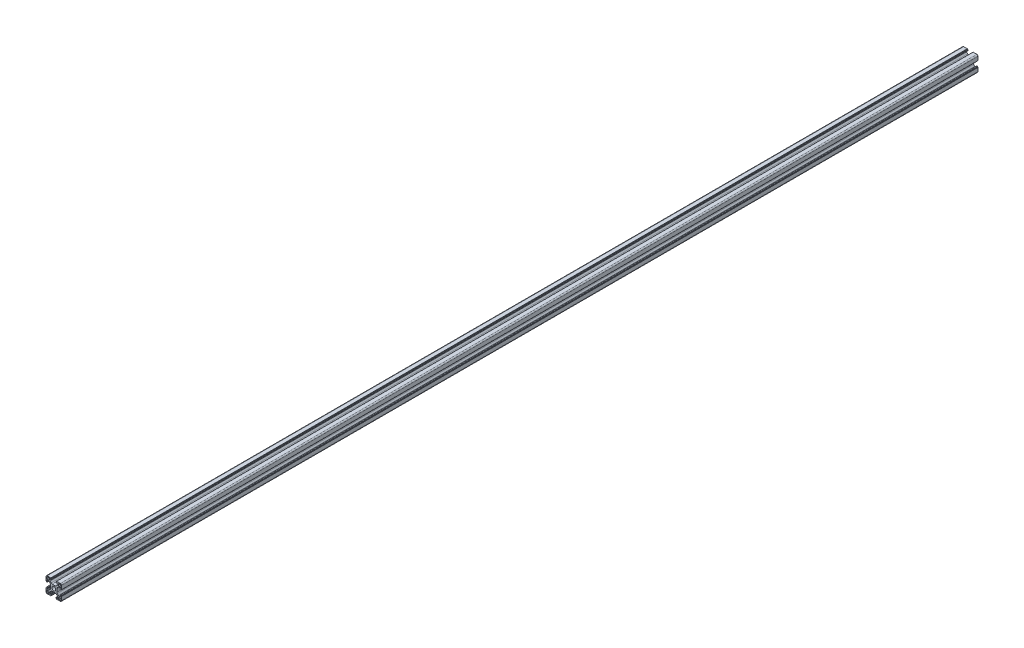
from build123d import *

# Parameters (mm, degrees)
EXTRUDE_1_DEPTH = 1180


with BuildPart() as part:
    # Эскиз1 → Бобышка-Вытянуть1 (new body)
    with BuildSketch(Plane.XY):
        with BuildLine():
            Line((-31.105150957, 65.209647948), (-29.206370287, 65.209647948))
            ThreePointArc((-29.206370287, 65.209647948), (-28.441003423, 65.361888883), (-27.792156725, 65.795434385))
            Line((-27.792156725, 65.795434385), (-26.490937394, 67.096653716))
            ThreePointArc((-26.490937394, 67.096653716), (-26.057391892, 67.745500414), (-25.905150957, 68.510867279))
            Line((-25.905150957, 68.510867279), (-25.905150957, 69.409647948))
            ThreePointArc((-25.905150957, 69.409647948), (-26.051597566, 69.763201338), (-26.405150957, 69.909647948))
            Line((-26.405150957, 69.909647948), (-26.508044175, 69.909647948))
            ThreePointArc((-26.508044175, 69.909647948), (-26.699385892, 69.871587714), (-26.861597566, 69.763201338))
            Line((-26.861597566, 69.763201338), (-27.341927652, 69.282871252))
            ThreePointArc((-27.341927652, 69.282871252), (-27.423033489, 69.228678065), (-27.518704347, 69.209647948))
            Line((-27.518704347, 69.209647948), (-27.805150957, 69.209647948))
            ThreePointArc((-27.805150957, 69.209647948), (-27.981927652, 69.282871252), (-28.055150957, 69.459647948))
            Line((-28.055150957, 69.459647948), (-28.055150957, 70.608718768))
            ThreePointArc((-28.055150957, 70.608718768), (-28.011216974, 70.714784785), (-27.905150957, 70.758718768))
            Line((-27.905150957, 70.758718768), (-27.405150957, 70.758718768))
            Line((-27.405150957, 70.758718768), (-27.405150957, 71.059647948))
            ThreePointArc((-27.405150957, 71.059647948), (-27.361216974, 71.165713965), (-27.255150957, 71.209647948))
            Line((-27.255150957, 71.209647948), (-22.605150957, 71.209647948))
            ThreePointArc((-22.605150957, 71.209647948), (-21.544490785, 70.770308119), (-21.105150957, 69.709647948))
            Line((-21.105150957, 69.709647948), (-21.105150957, 65.059647948))
            ThreePointArc((-21.105150957, 65.059647948), (-21.149084939, 64.953581931), (-21.255150957, 64.909647948))
            Line((-21.255150957, 64.909647948), (-21.556080136, 64.909647948))
            Line((-21.556080136, 64.909647948), (-21.556080136, 64.409647948))
            ThreePointArc((-21.556080136, 64.409647948), (-21.600014119, 64.303581931), (-21.706080136, 64.259647948))
            Line((-21.706080136, 64.259647948), (-22.855150957, 64.259647948))
            ThreePointArc((-22.855150957, 64.259647948), (-23.031927652, 64.332871252), (-23.105150957, 64.509647948))
            Line((-23.105150957, 64.509647948), (-23.105150957, 64.796094557))
            ThreePointArc((-23.105150957, 64.796094557), (-23.08612084, 64.891765415), (-23.031927652, 64.972871252))
            Line((-23.031927652, 64.972871252), (-22.551597566, 65.453201338))
            ThreePointArc((-22.551597566, 65.453201338), (-22.44321119, 65.615413013), (-22.405150957, 65.806754729))
            Line((-22.405150957, 65.806754729), (-22.405150957, 65.909647948))
            ThreePointArc((-22.405150957, 65.909647948), (-22.551597566, 66.263201338), (-22.905150957, 66.409647948))
            Line((-22.905150957, 66.409647948), (-23.803931626, 66.409647948))
            ThreePointArc((-23.803931626, 66.409647948), (-24.56929849, 66.257407013), (-25.218145188, 65.82386151))
            Line((-25.218145188, 65.82386151), (-26.519364519, 64.522642179))
            ThreePointArc((-26.519364519, 64.522642179), (-26.952910022, 63.873795482), (-27.105150957, 63.108428617))
            Line((-27.105150957, 63.108428617), (-27.105150957, 61.209647948))
            Line((-27.105150957, 61.209647948), (-27.105150957, 59.310867279))
            ThreePointArc((-27.105150957, 59.310867279), (-26.952910022, 58.545500414), (-26.519364519, 57.896653716))
            Line((-26.519364519, 57.896653716), (-25.218145188, 56.595434385))
            ThreePointArc((-25.218145188, 56.595434385), (-24.56929849, 56.161888883), (-23.803931626, 56.009647948))
            Line((-23.803931626, 56.009647948), (-22.905150957, 56.009647948))
            ThreePointArc((-22.905150957, 56.009647948), (-22.551597566, 56.156094557), (-22.405150957, 56.509647948))
            Line((-22.405150957, 56.509647948), (-22.405150957, 56.612541166))
            ThreePointArc((-22.405150957, 56.612541166), (-22.44321119, 56.803882883), (-22.551597566, 56.966094557))
            Line((-22.551597566, 56.966094557), (-23.031927652, 57.446424643))
            ThreePointArc((-23.031927652, 57.446424643), (-23.08612084, 57.52753048), (-23.105150957, 57.623201338))
            Line((-23.105150957, 57.623201338), (-23.105150957, 57.909647948))
            ThreePointArc((-23.105150957, 57.909647948), (-23.031927652, 58.086424643), (-22.855150957, 58.159647948))
            Line((-22.855150957, 58.159647948), (-21.706080136, 58.159647948))
            ThreePointArc((-21.706080136, 58.159647948), (-21.600014119, 58.115713965), (-21.556080136, 58.009647948))
            Line((-21.556080136, 58.009647948), (-21.556080136, 57.509647948))
            Line((-21.556080136, 57.509647948), (-21.255150957, 57.509647948))
            ThreePointArc((-21.255150957, 57.509647948), (-21.149084939, 57.465713965), (-21.105150957, 57.359647948))
            Line((-21.105150957, 57.359647948), (-21.105150957, 52.709647948))
            ThreePointArc((-21.105150957, 52.709647948), (-21.544490785, 51.648987776), (-22.605150957, 51.209647948))
            Line((-22.605150957, 51.209647948), (-27.255150957, 51.209647948))
            ThreePointArc((-27.255150957, 51.209647948), (-27.361216974, 51.253581931), (-27.405150957, 51.359647948))
            Line((-27.405150957, 51.359647948), (-27.405150957, 51.660577127))
            Line((-27.405150957, 51.660577127), (-27.905150957, 51.660577127))
            ThreePointArc((-27.905150957, 51.660577127), (-28.011216974, 51.70451111), (-28.055150957, 51.810577127))
            Line((-28.055150957, 51.810577127), (-28.055150957, 52.959647948))
            ThreePointArc((-28.055150957, 52.959647948), (-27.981927652, 53.136424643), (-27.805150957, 53.209647948))
            Line((-27.805150957, 53.209647948), (-27.518704347, 53.209647948))
            ThreePointArc((-27.518704347, 53.209647948), (-27.423033489, 53.190617831), (-27.341927652, 53.136424643))
            Line((-27.341927652, 53.136424643), (-26.861597566, 52.656094557))
            ThreePointArc((-26.861597566, 52.656094557), (-26.699385892, 52.547708181), (-26.508044175, 52.509647948))
            Line((-26.508044175, 52.509647948), (-26.405150957, 52.509647948))
            ThreePointArc((-26.405150957, 52.509647948), (-26.051597566, 52.656094557), (-25.905150957, 53.009647948))
            Line((-25.905150957, 53.009647948), (-25.905150957, 53.908428617))
            ThreePointArc((-25.905150957, 53.908428617), (-26.057391892, 54.673795482), (-26.490937394, 55.322642179))
            Line((-26.490937394, 55.322642179), (-27.792156725, 56.62386151))
            ThreePointArc((-27.792156725, 56.62386151), (-28.441003423, 57.057407013), (-29.206370287, 57.209647948))
            Line((-29.206370287, 57.209647948), (-31.105150957, 57.209647948))
            Line((-31.105150957, 57.209647948), (-33.003931626, 57.209647948))
            ThreePointArc((-33.003931626, 57.209647948), (-33.76929849, 57.057407013), (-34.418145188, 56.62386151))
            Line((-34.418145188, 56.62386151), (-35.719364519, 55.322642179))
            ThreePointArc((-35.719364519, 55.322642179), (-36.152910022, 54.673795482), (-36.305150957, 53.908428617))
            Line((-36.305150957, 53.908428617), (-36.305150957, 53.009647948))
            ThreePointArc((-36.305150957, 53.009647948), (-36.158704347, 52.656094557), (-35.805150957, 52.509647948))
            Line((-35.805150957, 52.509647948), (-35.702257738, 52.509647948))
            ThreePointArc((-35.702257738, 52.509647948), (-35.510916022, 52.547708181), (-35.348704347, 52.656094557))
            Line((-35.348704347, 52.656094557), (-34.868374261, 53.136424643))
            ThreePointArc((-34.868374261, 53.136424643), (-34.787268424, 53.190617831), (-34.691597566, 53.209647948))
            Line((-34.691597566, 53.209647948), (-34.405150957, 53.209647948))
            ThreePointArc((-34.405150957, 53.209647948), (-34.228374261, 53.136424643), (-34.155150957, 52.959647948))
            Line((-34.155150957, 52.959647948), (-34.155150957, 51.810577127))
            ThreePointArc((-34.155150957, 51.810577127), (-34.199084939, 51.70451111), (-34.305150957, 51.660577127))
            Line((-34.305150957, 51.660577127), (-34.805150957, 51.660577127))
            Line((-34.805150957, 51.660577127), (-34.805150957, 51.359647948))
            ThreePointArc((-34.805150957, 51.359647948), (-34.849084939, 51.253581931), (-34.955150957, 51.209647948))
            Line((-34.955150957, 51.209647948), (-39.605150957, 51.209647948))
            ThreePointArc((-39.605150957, 51.209647948), (-40.665811128, 51.648987776), (-41.105150957, 52.709647948))
            Line((-41.105150957, 52.709647948), (-41.105150957, 57.359647948))
            ThreePointArc((-41.105150957, 57.359647948), (-41.061216974, 57.465713965), (-40.955150957, 57.509647948))
            Line((-40.955150957, 57.509647948), (-40.654221777, 57.509647948))
            Line((-40.654221777, 57.509647948), (-40.654221777, 58.009647948))
            ThreePointArc((-40.654221777, 58.009647948), (-40.610287794, 58.115713965), (-40.504221777, 58.159647948))
            Line((-40.504221777, 58.159647948), (-39.355150957, 58.159647948))
            ThreePointArc((-39.355150957, 58.159647948), (-39.178374261, 58.086424643), (-39.105150957, 57.909647948))
            Line((-39.105150957, 57.909647948), (-39.105150957, 57.623201338))
            ThreePointArc((-39.105150957, 57.623201338), (-39.124181073, 57.52753048), (-39.178374261, 57.446424643))
            Line((-39.178374261, 57.446424643), (-39.658704347, 56.966094557))
            ThreePointArc((-39.658704347, 56.966094557), (-39.767090723, 56.803882883), (-39.805150957, 56.612541166))
            Line((-39.805150957, 56.612541166), (-39.805150957, 56.509647948))
            ThreePointArc((-39.805150957, 56.509647948), (-39.658704347, 56.156094557), (-39.305150957, 56.009647948))
            Line((-39.305150957, 56.009647948), (-38.406370287, 56.009647948))
            ThreePointArc((-38.406370287, 56.009647948), (-37.641003423, 56.161888883), (-36.992156725, 56.595434385))
            Line((-36.992156725, 56.595434385), (-35.690937394, 57.896653716))
            ThreePointArc((-35.690937394, 57.896653716), (-35.257391892, 58.545500414), (-35.105150957, 59.310867279))
            Line((-35.105150957, 59.310867279), (-35.105150957, 61.209647948))
            Line((-35.105150957, 61.209647948), (-35.105150957, 63.108428617))
            ThreePointArc((-35.105150957, 63.108428617), (-35.257391892, 63.873795482), (-35.690937394, 64.522642179))
            Line((-35.690937394, 64.522642179), (-36.992156725, 65.82386151))
            ThreePointArc((-36.992156725, 65.82386151), (-37.641003423, 66.257407013), (-38.406370287, 66.409647948))
            Line((-38.406370287, 66.409647948), (-39.305150957, 66.409647948))
            ThreePointArc((-39.305150957, 66.409647948), (-39.658704347, 66.263201338), (-39.805150957, 65.909647948))
            Line((-39.805150957, 65.909647948), (-39.805150957, 65.806754729))
            ThreePointArc((-39.805150957, 65.806754729), (-39.767090723, 65.615413013), (-39.658704347, 65.453201338))
            Line((-39.658704347, 65.453201338), (-39.178374261, 64.972871252))
            ThreePointArc((-39.178374261, 64.972871252), (-39.124181073, 64.891765415), (-39.105150957, 64.796094557))
            Line((-39.105150957, 64.796094557), (-39.105150957, 64.509647948))
            ThreePointArc((-39.105150957, 64.509647948), (-39.178374261, 64.332871252), (-39.355150957, 64.259647948))
            Line((-39.355150957, 64.259647948), (-40.504221777, 64.259647948))
            ThreePointArc((-40.504221777, 64.259647948), (-40.610287794, 64.303581931), (-40.654221777, 64.409647948))
            Line((-40.654221777, 64.409647948), (-40.654221777, 64.909647948))
            Line((-40.654221777, 64.909647948), (-40.955150957, 64.909647948))
            ThreePointArc((-40.955150957, 64.909647948), (-41.061216974, 64.953581931), (-41.105150957, 65.059647948))
            Line((-41.105150957, 65.059647948), (-41.105150957, 69.709647948))
            ThreePointArc((-41.105150957, 69.709647948), (-40.665811128, 70.770308119), (-39.605150957, 71.209647948))
            Line((-39.605150957, 71.209647948), (-34.955150957, 71.209647948))
            ThreePointArc((-34.955150957, 71.209647948), (-34.849084939, 71.165713965), (-34.805150957, 71.059647948))
            Line((-34.805150957, 71.059647948), (-34.805150957, 70.758718768))
            Line((-34.805150957, 70.758718768), (-34.305150957, 70.758718768))
            ThreePointArc((-34.305150957, 70.758718768), (-34.199084939, 70.714784785), (-34.155150957, 70.608718768))
            Line((-34.155150957, 70.608718768), (-34.155150957, 69.459647948))
            ThreePointArc((-34.155150957, 69.459647948), (-34.228374261, 69.282871252), (-34.405150957, 69.209647948))
            Line((-34.405150957, 69.209647948), (-34.691597566, 69.209647948))
            ThreePointArc((-34.691597566, 69.209647948), (-34.787268424, 69.228678065), (-34.868374261, 69.282871252))
            Line((-34.868374261, 69.282871252), (-35.348704347, 69.763201338))
            ThreePointArc((-35.348704347, 69.763201338), (-35.510916022, 69.871587714), (-35.702257738, 69.909647948))
            Line((-35.702257738, 69.909647948), (-35.805150957, 69.909647948))
            ThreePointArc((-35.805150957, 69.909647948), (-36.158704347, 69.763201338), (-36.305150957, 69.409647948))
            Line((-36.305150957, 69.409647948), (-36.305150957, 68.510867279))
            ThreePointArc((-36.305150957, 68.510867279), (-36.152910022, 67.745500414), (-35.719364519, 67.096653716))
            Line((-35.719364519, 67.096653716), (-34.418145188, 65.795434385))
            ThreePointArc((-34.418145188, 65.795434385), (-33.76929849, 65.361888883), (-33.003931626, 65.209647948))
            Line((-33.003931626, 65.209647948), (-31.105150957, 65.209647948))
        make_face()
        with BuildLine():
            Line((-24.205150957, 67.309647948), (-22.805150957, 67.309647948))
            ThreePointArc((-22.805150957, 67.309647948), (-22.239465532, 67.543962523), (-22.005150957, 68.109647948))
            Line((-22.005150957, 68.109647948), (-22.005150957, 69.509647948))
            ThreePointArc((-22.005150957, 69.509647948), (-22.239465532, 70.075333373), (-22.805150957, 70.309647948))
            Line((-22.805150957, 70.309647948), (-24.205150957, 70.309647948))
            ThreePointArc((-24.205150957, 70.309647948), (-24.770836381, 70.075333373), (-25.005150957, 69.509647948))
            Line((-25.005150957, 69.509647948), (-25.005150957, 68.109647948))
            ThreePointArc((-25.005150957, 68.109647948), (-24.770836381, 67.543962523), (-24.205150957, 67.309647948))
        make_face(mode=Mode.SUBTRACT)
        with BuildLine():
            Line((-25.005150957, 54.309647948), (-25.005150957, 52.909647948))
            ThreePointArc((-25.005150957, 52.909647948), (-24.770836381, 52.343962523), (-24.205150957, 52.109647948))
            Line((-24.205150957, 52.109647948), (-22.805150957, 52.109647948))
            ThreePointArc((-22.805150957, 52.109647948), (-22.239465532, 52.343962523), (-22.005150957, 52.909647948))
            Line((-22.005150957, 52.909647948), (-22.005150957, 54.309647948))
            ThreePointArc((-22.005150957, 54.309647948), (-22.239465532, 54.875333373), (-22.805150957, 55.109647948))
            Line((-22.805150957, 55.109647948), (-24.205150957, 55.109647948))
            ThreePointArc((-24.205150957, 55.109647948), (-24.770836381, 54.875333373), (-25.005150957, 54.309647948))
        make_face(mode=Mode.SUBTRACT)
        with BuildLine():
            Line((-38.005150957, 55.109647948), (-39.405150957, 55.109647948))
            ThreePointArc((-39.405150957, 55.109647948), (-39.970836381, 54.875333373), (-40.205150957, 54.309647948))
            Line((-40.205150957, 54.309647948), (-40.205150957, 52.909647948))
            ThreePointArc((-40.205150957, 52.909647948), (-39.970836381, 52.343962523), (-39.405150957, 52.109647948))
            Line((-39.405150957, 52.109647948), (-38.005150957, 52.109647948))
            ThreePointArc((-38.005150957, 52.109647948), (-37.439465532, 52.343962523), (-37.205150957, 52.909647948))
            Line((-37.205150957, 52.909647948), (-37.205150957, 54.309647948))
            ThreePointArc((-37.205150957, 54.309647948), (-37.439465532, 54.875333373), (-38.005150957, 55.109647948))
        make_face(mode=Mode.SUBTRACT)
        with BuildLine():
            Line((-37.205150957, 68.109647948), (-37.205150957, 69.509647948))
            ThreePointArc((-37.205150957, 69.509647948), (-37.439465532, 70.075333373), (-38.005150957, 70.309647948))
            Line((-38.005150957, 70.309647948), (-39.405150957, 70.309647948))
            ThreePointArc((-39.405150957, 70.309647948), (-39.970836381, 70.075333373), (-40.205150957, 69.509647948))
            Line((-40.205150957, 69.509647948), (-40.205150957, 68.109647948))
            ThreePointArc((-40.205150957, 68.109647948), (-39.970836381, 67.543962523), (-39.405150957, 67.309647948))
            Line((-39.405150957, 67.309647948), (-38.005150957, 67.309647948))
            ThreePointArc((-38.005150957, 67.309647948), (-37.439465532, 67.543962523), (-37.205150957, 68.109647948))
        make_face(mode=Mode.SUBTRACT)
        with BuildLine():
            ThreePointArc((-28.605150957, 61.209647948), (-29.337384004, 62.977414901), (-31.105150957, 63.709647948))
            ThreePointArc((-31.105150957, 63.709647948), (-32.87291791, 62.977414901), (-33.605150957, 61.209647948))
            ThreePointArc((-33.605150957, 61.209647948), (-32.87291791, 59.441880995), (-31.105150957, 58.709647948))
            ThreePointArc((-31.105150957, 58.709647948), (-29.337384004, 59.441880995), (-28.605150957, 61.209647948))
        make_face(mode=Mode.SUBTRACT)
    extrude(amount=EXTRUDE_1_DEPTH)


solid = part.part
